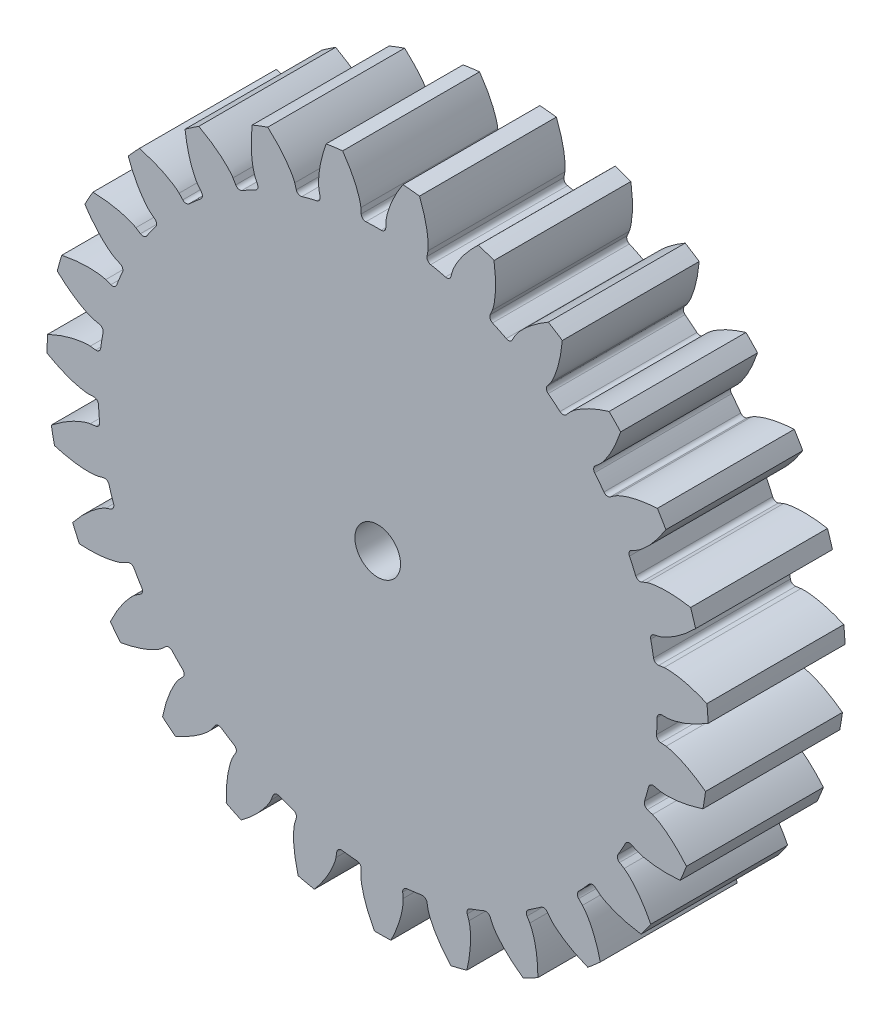
from build123d import *

# Parameters (mm, degrees)
SKETCH1_R                 = 7.25
SKETCH1_R_2               = 0.5
BOSS_EXTRUDE1_DEPTH       = 3
CUT_EXTRUDE1_DEPTH        = 11.68293031
FILLET1_R                 = 0.1
FILLET2_R                 = 0.1
CIRPATTERN14_COUNT        = 27
FILLET1_OF_CIRPATTERN14_R = 0.1
FILLET2_OF_CIRPATTERN14_R = 0.1


with BuildPart() as part:
    # Sketch1 → Boss-Extrude1 (new body)
    with BuildSketch(Plane.XY):
        Circle(SKETCH1_R)
        Circle(SKETCH1_R_2, mode=Mode.SUBTRACT)
    extrude(amount=BOSS_EXTRUDE1_DEPTH)

    # Sketch3 → Cut-Extrude1 (cut, symmetric)
    with BuildSketch(Plane.XY):
        with BuildLine():
            Line((6.34292519, 0), (6.125, 0))
            ThreePointArc((6.125, 0), (6.119266134, -0.264965992), (6.102075273, -0.529435892))
            Line((6.102075273, -0.529435892), (6.31918481, -0.548273021))
            add(Edge.make_bspline(
                [(6.31918481, -0.548273021), (6.321342351, -0.54849153), (6.327383846, -0.549200504), (6.345975445, -0.552009807), (6.382417591, -0.559290703), (6.427009257, -0.570765396), (6.477828124, -0.586319481), (6.526461509, -0.603178109), (6.567770361, -0.618732734), (6.608707339, -0.635305555), (6.649231899, -0.65276424), (6.698000566, -0.675027935), (6.756022956, -0.703271548), (6.823130602, -0.738519359), (6.89836478, -0.781120059), (6.974039751, -0.827312942), (7.047659749, -0.875038465), (7.11001768, -0.918224097), (7.152541616, -0.948795144), (7.177380092, -0.96716289), (7.18448503, -0.972458148)],
                knots=[0, 0, 0, 0, 0, 0.005376749, 0.015083688, 0.04661014, 0.092110525, 0.119476176, 0.146842496, 0.174208854, 0.201574956, 0.228941013, 0.256307345, 0.307035032, 0.361767352, 0.416499661, 0.471231937, 0.525964282, 0.580696616, 0.602617834, 0.602617834, 0.602617834, 0.602617834, 0.602617834], degree=4))
            ThreePointArc((7.18448503, -0.972458148), (7.233602715, -0.487331268), (7.25, 0))
            ThreePointArc((7.25, 0), (7.247912871, 0.173951185), (7.241652686, 0.347802217))
            add(Edge.make_bspline(
                [(6.34292519, 0), (6.345093544, 3.1196e-05), (6.351173709, 0.000215298), (6.369938555, 0.001407057), (6.406873655, 0.005510697), (6.452290278, 0.013088005), (6.504263411, 0.024191167), (6.554172006, 0.036782899), (6.596670765, 0.04870863), (6.638887053, 0.061680891), (6.68076904, 0.075571348), (6.731279617, 0.093536223), (6.791526175, 0.116658756), (6.861429418, 0.145973956), (6.94006435, 0.18191208), (7.019448928, 0.221390839), (7.096918703, 0.262574131), (7.162776142, 0.300208), (7.207783435, 0.326988921), (7.234116626, 0.343140919), (7.241652686, 0.347802217)],
                knots=[0, 0, 0, 0, 0, 0.005376749, 0.015083688, 0.04661014, 0.092110525, 0.119476176, 0.146842496, 0.174208854, 0.201574956, 0.228941013, 0.256307345, 0.307035032, 0.361767352, 0.416499661, 0.471231937, 0.525964282, 0.580696616, 0.602617834, 0.602617834, 0.602617834, 0.602617834, 0.602617834], degree=4))
        make_face()
    cut_extrude1 = extrude(amount=CUT_EXTRUDE1_DEPTH, both=True, mode=Mode.SUBTRACT)

    # Fillet1
    fillet1_edges = [part.edges().sort_by_distance(p)[0] for p in [
        (6.102075273, -0.529435892, 1.5),
    ]]
    fillet(fillet1_edges, radius=FILLET1_R)

    # Fillet2
    fillet2_edges = [part.edges().sort_by_distance(p)[0] for p in [
        (6.125, 0, 1.5),
    ]]
    fillet(fillet2_edges, radius=FILLET2_R)

    # CirPattern14: Cut-Extrude1 ×27 about axis
    cirpattern14_axis = Axis((0, 0, 3), (0, 0, -1))
    for i in range(1, CIRPATTERN14_COUNT):
        add(cut_extrude1.rotate(cirpattern14_axis, i * 360 / CIRPATTERN14_COUNT), mode=Mode.SUBTRACT)

    # Fillet1 of CirPattern14
    fillet1_of_cirpattern14_edges = [part.edges().sort_by_distance(p)[0] for p in [
        (5.815496725, -1.922400281, 1.5),
        (5.215403243, -3.211727574, 1.5),
        (4.334146023, -4.327909802, 1.5),
        (3.219233868, -5.210773292, 1.5),
        (1.930771983, -5.812722645, 1.5),
        (0.53822168, -6.101306616, 1.5),
        (-0.883344293, -6.060967568, 1.5),
        (-2.257288946, -5.693880189, 1.5),
        (-3.509542569, -5.019834256, 1.5),
        (-4.572595842, -4.075167759, 1.5),
        (-5.389139291, -2.910807913, 1.5),
        (-5.915152845, -1.589525659, 1.5),
        (-6.122278978, -0.182551665, 1.5),
        (-5.999351467, 1.234263736, 1.5),
        (-5.552997366, 2.58453966, 1.5),
        (-4.807279739, 3.795482382, 1.5),
        (-3.802400417, 4.801809666, 1.5),
        (-2.592532704, 5.549270148, 1.5),
        (-1.242900883, 5.99756804, 1.5),
        (0.173736047, 6.122535487, 1.5),
        (1.581006822, 5.91743546, 1.5),
        (2.90304511, 5.393324957, 1.5),
        (4.068579484, 4.578458909, 1.5),
        (5.014775686, 3.516766956, 1.5),
        (5.690624032, 2.265485186, 1.5),
        (6.059689363, 0.892070523, 1.5),
    ]]
    fillet(fillet1_of_cirpattern14_edges, radius=FILLET1_OF_CIRPATTERN14_R)

    # Fillet2 of CirPattern14
    fillet2_of_cirpattern14_edges = [part.edges().sort_by_distance(p)[0] for p in [
        (5.959899832, -1.412522208, 1.5),
        (5.473499922, -2.748894979, 1.5),
        (4.692022214, -3.937074109, 1.5),
        (3.657596374, -4.913004556, 1.5),
        (2.425988567, -5.624073655, 1.5),
        (1.063595088, -6.031947487, 1.5),
        (-0.356137077, -6.114637469, 1.5),
        (-1.7566698, -5.867685763, 1.5),
        (-3.0625, -5.304405598, 1.5),
        (-4.203230032, -4.455163555, 1.5),
        (-5.117362845, -3.365742491, 1.5),
        (-5.755617302, -2.094873378, 1.5),
        (-6.083584941, -0.711069099, 1.5),
        (-6.083584941, 0.711069099, 1.5),
        (-5.755617302, 2.094873378, 1.5),
        (-5.117362845, 3.365742491, 1.5),
        (-4.203230032, 4.455163555, 1.5),
        (-3.0625, 5.304405598, 1.5),
        (-1.7566698, 5.867685763, 1.5),
        (-0.356137077, 6.114637469, 1.5),
        (1.063595088, 6.031947487, 1.5),
        (2.425988567, 5.624073655, 1.5),
        (3.657596374, 4.913004556, 1.5),
        (4.692022214, 3.937074109, 1.5),
        (5.473499922, 2.748894979, 1.5),
        (5.959899832, 1.412522208, 1.5),
    ]]
    fillet(fillet2_of_cirpattern14_edges, radius=FILLET2_OF_CIRPATTERN14_R)


solid = part.part
